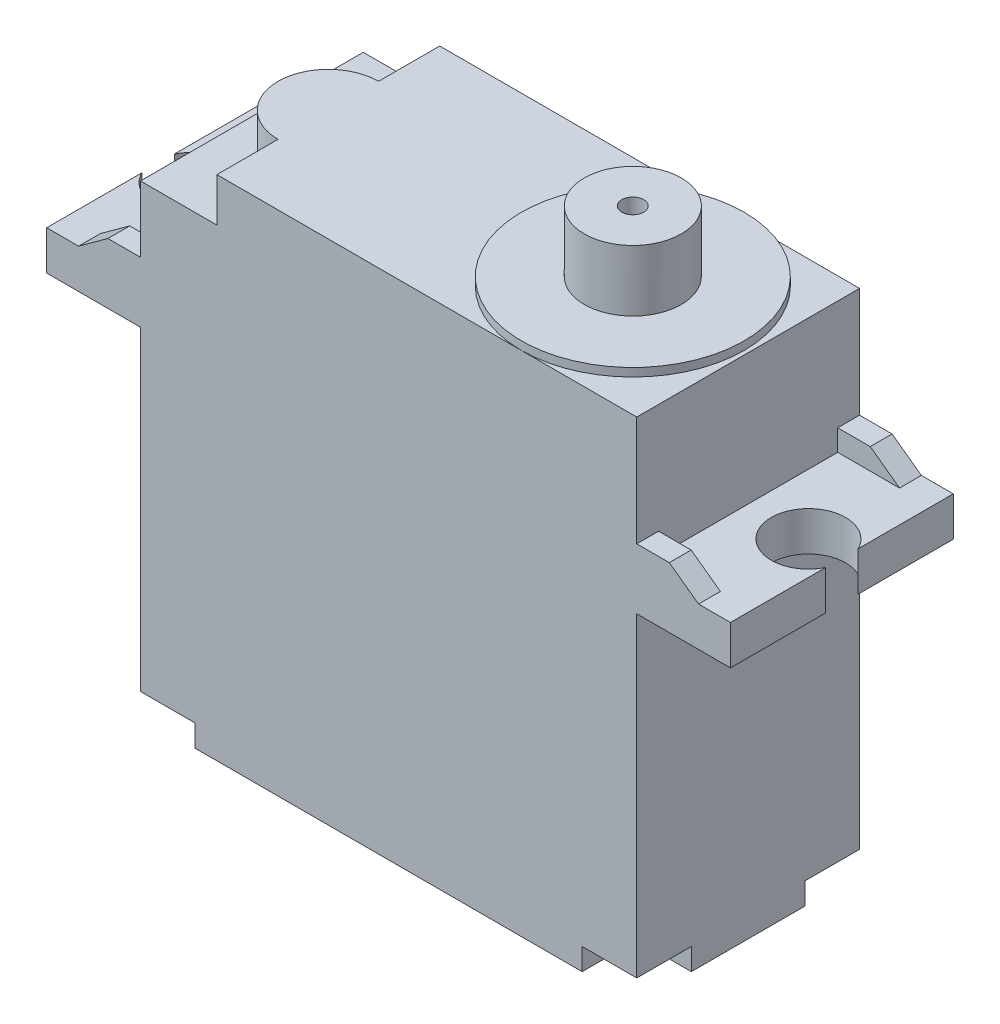
from build123d import *

# Parameters (mm, degrees)
SKETCH1_R               = 2.8194
BOSS_EXTRUDE1_DEPTH     = 3.556
SKETCH2_R               = 6.477
BOSS_EXTRUDE2_DEPTH     = 0.4826
SKETCH3_W               = 28.8544
SKETCH3_H               = 12.954
BOSS_EXTRUDE3_DEPTH     = 29.5148
SKETCH4_R               = 0.635
CUT_EXTRUDE1_DEPTH      = 3.937
SKETCH5_W               = 12.954
SKETCH5_H               = 2.286
BOSS_EXTRUDE4_DEPTH     = 5.4483
BOSS_EXTRUDE5_DEPTH     = 1.27
SKETCH7_R               = 2.159
CUT_EXTRUDE2_DEPTH      = 32.810424981
MIRROR3_COPY_1_DEPTH    = 1.27
CUT_EXTRUDE3_DEPTH      = 2.54
SKETCH10_R              = 1.5875
CUT_EXTRUDE4_DEPTH      = 1.27
MIRROR5_COPY_1_SKETCH_R = 1.5875
MIRROR5_COPY_1_DEPTH    = 1.27


with BuildPart() as part:
    # Sketch1 → Boss-Extrude1 (new body)
    with BuildSketch(Plane(origin=(0, 0, 0), x_dir=(1, 0, 0), z_dir=(0, 1, 0))):
        with Locations(Location((0, 0, 0), (0, 0, 270))):
            Circle(SKETCH1_R)
    extrude(amount=BOSS_EXTRUDE1_DEPTH)

    # Sketch2 → Boss-Extrude2 (add)
    with BuildSketch(Plane(origin=(0, 0, 0), x_dir=(-1, 0, 0), z_dir=(0, -1, 0))):
        with Locations(Location((0, 0, 0), (0, 0, 270))):
            Circle(SKETCH2_R)
    extrude(amount=BOSS_EXTRUDE2_DEPTH)

    # Sketch3 → Boss-Extrude3 (add)
    with BuildSketch(Plane(origin=(0, -0.4826, 0), x_dir=(-1, 0, 0), z_dir=(0, -1, 0))):
        with Locations((7.7216, 0)):
            Rectangle(SKETCH3_W, SKETCH3_H)
    extrude(amount=BOSS_EXTRUDE3_DEPTH)

    # Sketch4 → Cut-Extrude1 (cut)
    with BuildSketch(Plane(origin=(0, 3.556, 0), x_dir=(1, 0, 0), z_dir=(0, 1, 0))):
        with Locations(Location((0, 0, 0), (0, 0, 270))):
            Circle(SKETCH4_R)
    extrude(amount=-CUT_EXTRUDE1_DEPTH, mode=Mode.SUBTRACT)

    # Sketch5 → Boss-Extrude4 (add)
    with BuildSketch(Plane(origin=(6.7056, 0, 0), x_dir=(0, 0, -1), z_dir=(1, 0, 0))):
        with Locations((0, -9.2456)):
            Rectangle(SKETCH5_W, SKETCH5_H)
    boss_extrude4 = extrude(amount=BOSS_EXTRUDE4_DEPTH)

    # Sketch6 → Boss-Extrude5 (add)
    with BuildSketch(Plane.XY.offset(6.477)):
        Polygon((6.7056, -8.1026), (10.2997, -8.1026), (8.5979, -6.866466582), (6.7056, -6.866466582), align=None)
    boss_extrude5 = extrude(amount=-BOSS_EXTRUDE5_DEPTH)

    # Mirror1: Boss-Extrude5 across plane
    add(boss_extrude5.mirror(Plane.XY))

    # Sketch7 → Cut-Extrude2 (cut, through all)
    with BuildSketch(Plane(origin=(0, -8.1026, 0), x_dir=(1, 0, 0), z_dir=(0, 1, 0))):
        with Locations((10.2108, 0)):
            Circle(SKETCH7_R)
    cut_extrude2 = extrude(amount=-CUT_EXTRUDE2_DEPTH, mode=Mode.SUBTRACT)

    # Mirror3: Boss-Extrude4, Boss-Extrude5, Cut-Extrude2 across plane
    add(boss_extrude4.mirror(Plane(origin=(-7.7216, 0, 0), x_dir=(0, 0, 1), z_dir=(1, 0, 0))))
    add(boss_extrude5.mirror(Plane(origin=(-7.7216, 0, 0), x_dir=(0, 0, 1), z_dir=(1, 0, 0))))
    add(cut_extrude2.mirror(Plane(origin=(-7.7216, 0, 0), x_dir=(0, 0, 1), z_dir=(1, 0, 0))), mode=Mode.SUBTRACT)

    # Mirror3 copy 1 sketch → Mirror3 copy 1 (add)
    with BuildSketch(Plane(origin=(-15.4432, 0, -6.477), x_dir=(-1, 0, 0), z_dir=(0, 0, -1))):
        Polygon((6.7056, -8.1026), (10.2997, -8.1026), (8.5979, -6.866466582), (6.7056, -6.866466582), align=None)
    extrude(amount=-MIRROR3_COPY_1_DEPTH)

    # Sketch9 → Cut-Extrude3 (cut)
    with BuildSketch(Plane(origin=(0, -0.4826, 0), x_dir=(1, 0, 0), z_dir=(0, 1, 0))):
        with BuildLine():
            Line((-22.1488, 6.477), (-22.1488, -6.477))
            Line((-22.1488, -6.477), (-17.7038, -6.477))
            Line((-17.7038, -6.477), (-17.7038, -2.921))
            ThreePointArc((-17.7038, -2.921), (-20.6248, 0), (-17.7038, 2.921))
            Line((-17.7038, 2.921), (-17.7038, 6.477))
            Line((-17.7038, 6.477), (-22.1488, 6.477))
        make_face()
    extrude(amount=-CUT_EXTRUDE3_DEPTH, mode=Mode.SUBTRACT)

    # Sketch10 → Cut-Extrude4 (cut)
    with BuildSketch(Plane(origin=(0, -29.9974, 0), x_dir=(-1, 0, 0), z_dir=(0, -1, 0))):
        with Locations((20.5613, 4.8895)):
            Circle(SKETCH10_R)
        with BuildLine():
            Line((22.1488, 6.477), (20.5613, 6.477))
            ThreePointArc((20.5613, 6.477), (21.683832015, 6.012032015), (22.1488, 4.8895))
            Line((22.1488, 4.8895), (22.1488, 6.477))
        make_face()
        with BuildLine():
            ThreePointArc((18.9738, 4.8895), (19.438767985, 6.012032015), (20.5613, 6.477))
            Line((20.5613, 6.477), (18.9738, 6.477))
            Line((18.9738, 6.477), (18.9738, 4.8895))
        make_face()
        with BuildLine():
            Line((22.1488, 3.302), (22.1488, 4.8895))
            ThreePointArc((22.1488, 4.8895), (21.683832015, 3.766967985), (20.5613, 3.302))
            Line((20.5613, 3.302), (22.1488, 3.302))
        make_face()
    cut_extrude4 = extrude(amount=-CUT_EXTRUDE4_DEPTH, mode=Mode.SUBTRACT)

    # Mirror4: Cut-Extrude4 across plane
    add(cut_extrude4.mirror(Plane.XY), mode=Mode.SUBTRACT)

    # Mirror5: Cut-Extrude4 across plane
    add(cut_extrude4.mirror(Plane(origin=(-7.7216, 0, 0), x_dir=(0, 0, 1), z_dir=(1, 0, 0))), mode=Mode.SUBTRACT)

    # Mirror5 copy 1 sketch → Mirror5 copy 1 (cut)
    with BuildSketch(Plane(origin=(-15.4432, -29.9974, 0), x_dir=(1, 0, 0), z_dir=(0, -1, 0))):
        with Locations((20.5613, 4.8895)):
            Circle(MIRROR5_COPY_1_SKETCH_R)
        with BuildLine():
            Line((22.1488, 6.477), (20.5613, 6.477))
            ThreePointArc((20.5613, 6.477), (21.683832015, 6.012032015), (22.1488, 4.8895))
            Line((22.1488, 4.8895), (22.1488, 6.477))
        make_face()
        with BuildLine():
            ThreePointArc((18.9738, 4.8895), (19.438767985, 6.012032015), (20.5613, 6.477))
            Line((20.5613, 6.477), (18.9738, 6.477))
            Line((18.9738, 6.477), (18.9738, 4.8895))
        make_face()
        with BuildLine():
            Line((22.1488, 3.302), (22.1488, 4.8895))
            ThreePointArc((22.1488, 4.8895), (21.683832015, 3.766967985), (20.5613, 3.302))
            Line((20.5613, 3.302), (22.1488, 3.302))
        make_face()
    extrude(amount=-MIRROR5_COPY_1_DEPTH, mode=Mode.SUBTRACT)


solid = part.part
